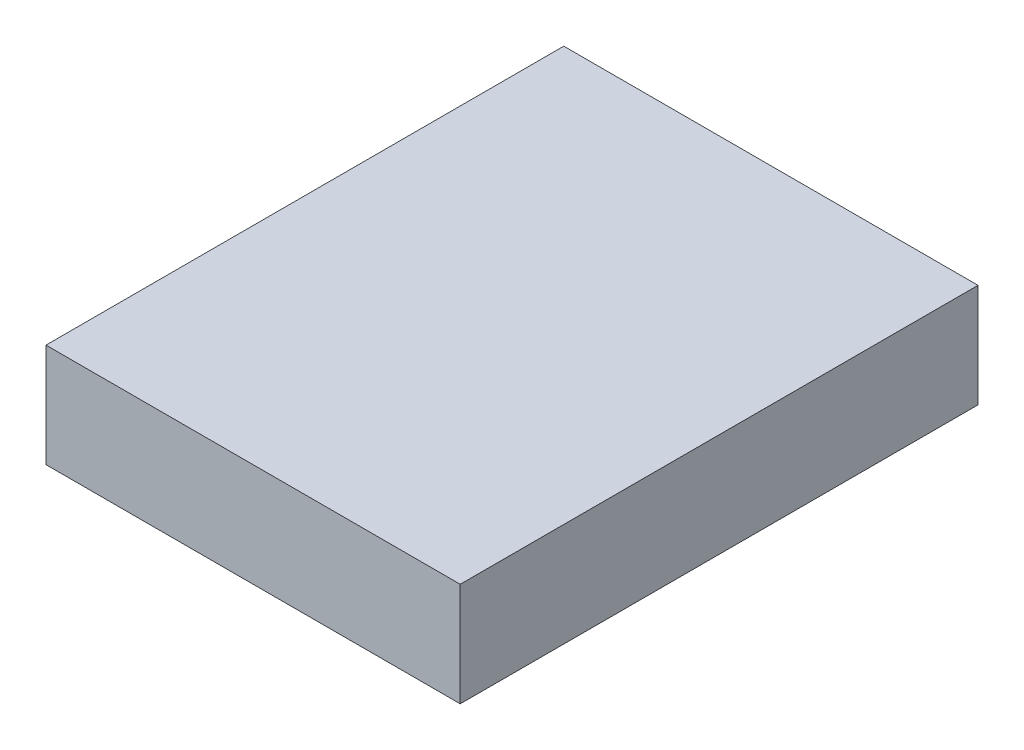
from build123d import *

# Parameters (mm, degrees)
SKETCH1_W           = 10.16
SKETCH1_H           = 12.7
BOSS_EXTRUDE1_DEPTH = 2.54


with BuildPart() as part:
    # Sketch1 → Boss-Extrude1 (new body)
    with BuildSketch(Plane(origin=(0, 0, 0), x_dir=(1, 0, 0), z_dir=(0, 1, 0))):
        with Locations((5.08, 6.35)):
            Rectangle(SKETCH1_W, SKETCH1_H)
    extrude(amount=BOSS_EXTRUDE1_DEPTH)


solid = part.part
